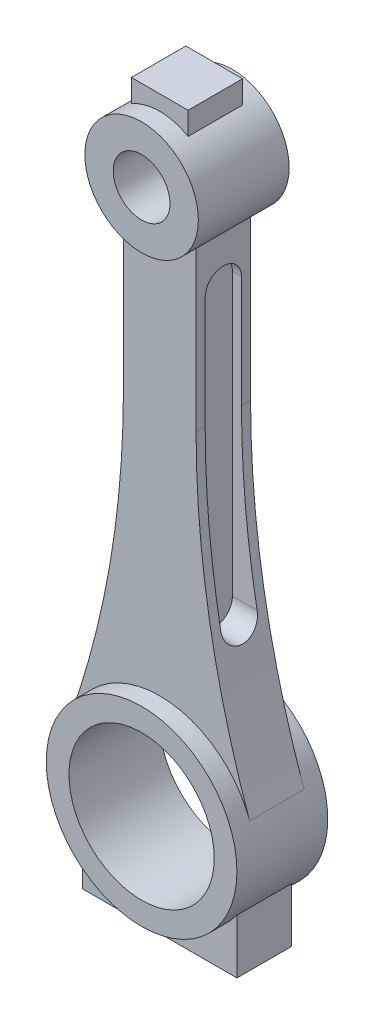
from build123d import *

# Parameters (mm, degrees)
SKETCH1_R             = 12.5
SKETCH1_R_2           = 6.25
BOSS_EXTRUDE1_DEPTH   = 10
SKETCH1_R_3           = 21
SKETCH1_R_4           = 16
BOSS_EXTRUDE1_2_DEPTH = 10
BOSS_EXTRUDE2_DEPTH   = 6
CUT_EXTRUDE1_START    = 6
CUT_EXTRUDE1_DEPTH    = 132.802456026
CUT_EXTRUDE3_START    = -6
CUT_EXTRUDE3_DEPTH    = 132.802456026


with BuildPart() as part:
    # Sketch1 → Boss-Extrude1 (new, symmetric)
    with BuildSketch(Plane.XY):
        with Locations((0, 120)):
            Circle(SKETCH1_R)
        with Locations((0, 120)):
            Circle(SKETCH1_R_2, mode=Mode.SUBTRACT)
    extrude(amount=BOSS_EXTRUDE1_DEPTH, both=True)



with BuildPart() as body_2:
    # Sketch1 → Boss-Extrude1 2 (new, symmetric)
    with BuildSketch(Plane.XY):
        Circle(SKETCH1_R_3)
        Circle(SKETCH1_R_4, mode=Mode.SUBTRACT)
    extrude(amount=BOSS_EXTRUDE1_2_DEPTH, both=True)


with BuildPart() as part_1:
    add(part.part)

    add(body_2.part)  # Boss-Extrude2 merges body 2
    # Sketch1<3> → Boss-Extrude2 (add, symmetric)
    with BuildSketch(Plane.XY):
        with BuildLine():
            Line((6.25, 135.825317547), (-6.25, 135.825317547))
            Line((-6.25, 135.825317547), (-6.25, 130.825317547))
            ThreePointArc((-6.25, 130.825317547), (0, 132.5), (6.25, 130.825317547))
            Line((6.25, 130.825317547), (6.25, 135.825317547))
        make_face()
        with BuildLine():
            Line((-8, 110.395313644), (-8, 75.395313644))
            ThreePointArc((-8, 75.395313644), (-10.96842855, 40.709642053), (-19.787382488, 7.032744434))
            ThreePointArc((-19.787382488, 7.032744434), (0, 21), (19.787382488, 7.032744434))
            ThreePointArc((19.787382488, 7.032744434), (10.96842855, 40.709642053), (8, 75.395313644))
            Line((8, 75.395313644), (8, 110.395313644))
            ThreePointArc((8, 110.395313644), (0, 107.5), (-8, 110.395313644))
        make_face()
        with BuildLine():
            Line((-17, -12.328828006), (-17, -24.328828006))
            Line((-17, -24.328828006), (17, -24.328828006))
            Line((17, -24.328828006), (17, -12.328828006))
            ThreePointArc((17, -12.328828006), (0, -21), (-17, -12.328828006))
        make_face()
    extrude(amount=BOSS_EXTRUDE2_DEPTH, both=True)

    # Sketch2 → Cut-Extrude1 (cut, through all)
    with BuildSketch(Plane(origin=(0, 0, 0), x_dir=(0, 0, -1), z_dir=(1, 0, 0)).offset(CUT_EXTRUDE1_START)):
        with BuildLine():
            Line((4, 100), (4, 38))
            ThreePointArc((4, 38), (0, 34), (-4, 38))
            Line((-4, 38), (-4, 100))
            ThreePointArc((-4, 100), (0, 104), (4, 100))
        make_face()
    extrude(amount=CUT_EXTRUDE1_DEPTH, mode=Mode.SUBTRACT)

    # Sketch2<3> → Cut-Extrude3 (cut, through all)
    with BuildSketch(Plane(origin=(0, 0, 0), x_dir=(0, 0, -1), z_dir=(1, 0, 0)).offset(CUT_EXTRUDE3_START)):
        with BuildLine():
            Line((4, 100), (4, 38))
            ThreePointArc((4, 38), (0, 34), (-4, 38))
            Line((-4, 38), (-4, 100))
            ThreePointArc((-4, 100), (0, 104), (4, 100))
        make_face()
    extrude(amount=-CUT_EXTRUDE3_DEPTH, mode=Mode.SUBTRACT)


solid = part_1.part
